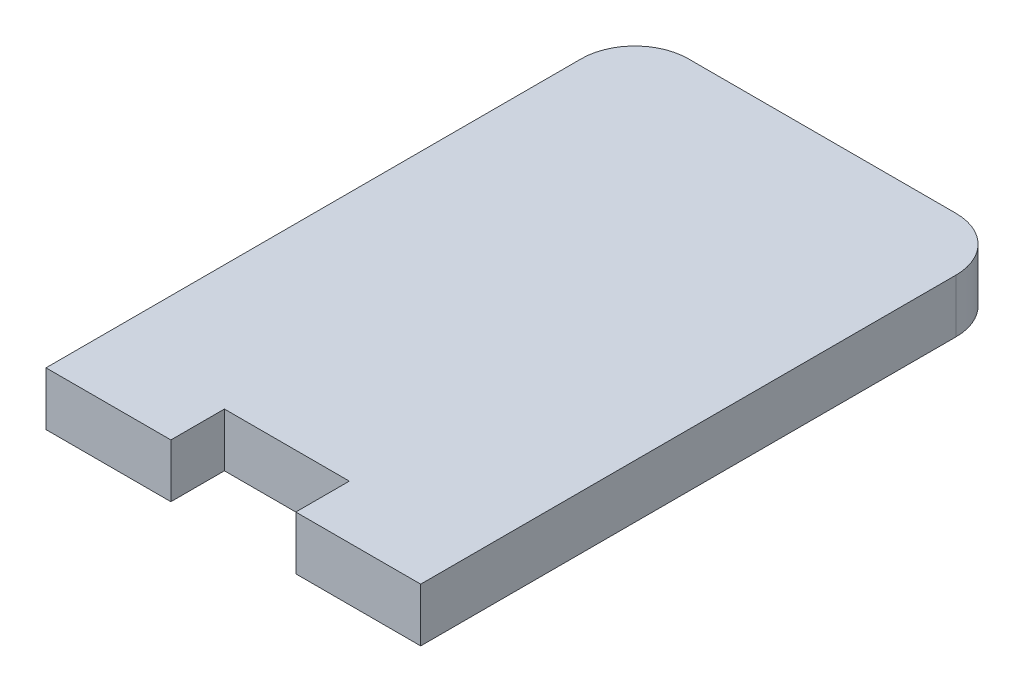
from build123d import *

# Parameters (mm, degrees)
SKETCH2_W           = 21
SKETCH2_H           = 33
BOSS_EXTRUDE1_DEPTH = 3
SKETCH4_W           = 7
SKETCH4_H           = 3
CUT_EXTRUDE2_DEPTH  = 3
FILLET1_R           = 3
FILLET2_R           = 3


with BuildPart() as part:
    # Sketch2 → Boss-Extrude1 (new body)
    with BuildSketch(Plane(origin=(0, 0, 0), x_dir=(1, 0, 0), z_dir=(0, 1, 0))):
        Rectangle(SKETCH2_W, SKETCH2_H)
    extrude(amount=BOSS_EXTRUDE1_DEPTH)

    # Sketch4 → Cut-Extrude2 (cut)
    with BuildSketch(Plane(origin=(0, 3, 0), x_dir=(1, 0, 0), z_dir=(0, 1, 0))):
        with Locations((0, -15)):
            Rectangle(SKETCH4_W, SKETCH4_H)
    extrude(amount=-CUT_EXTRUDE2_DEPTH, mode=Mode.SUBTRACT)

    # Fillet1
    fillet1_edges = [part.edges().sort_by_distance(p)[0] for p in [
        (-10.5, 1.5, -16.5),
    ]]
    fillet(fillet1_edges, radius=FILLET1_R)

    # Fillet2
    fillet2_edges = [part.edges().sort_by_distance(p)[0] for p in [
        (10.5, 1.5, -16.5),
    ]]
    fillet(fillet2_edges, radius=FILLET2_R)


solid = part.part
